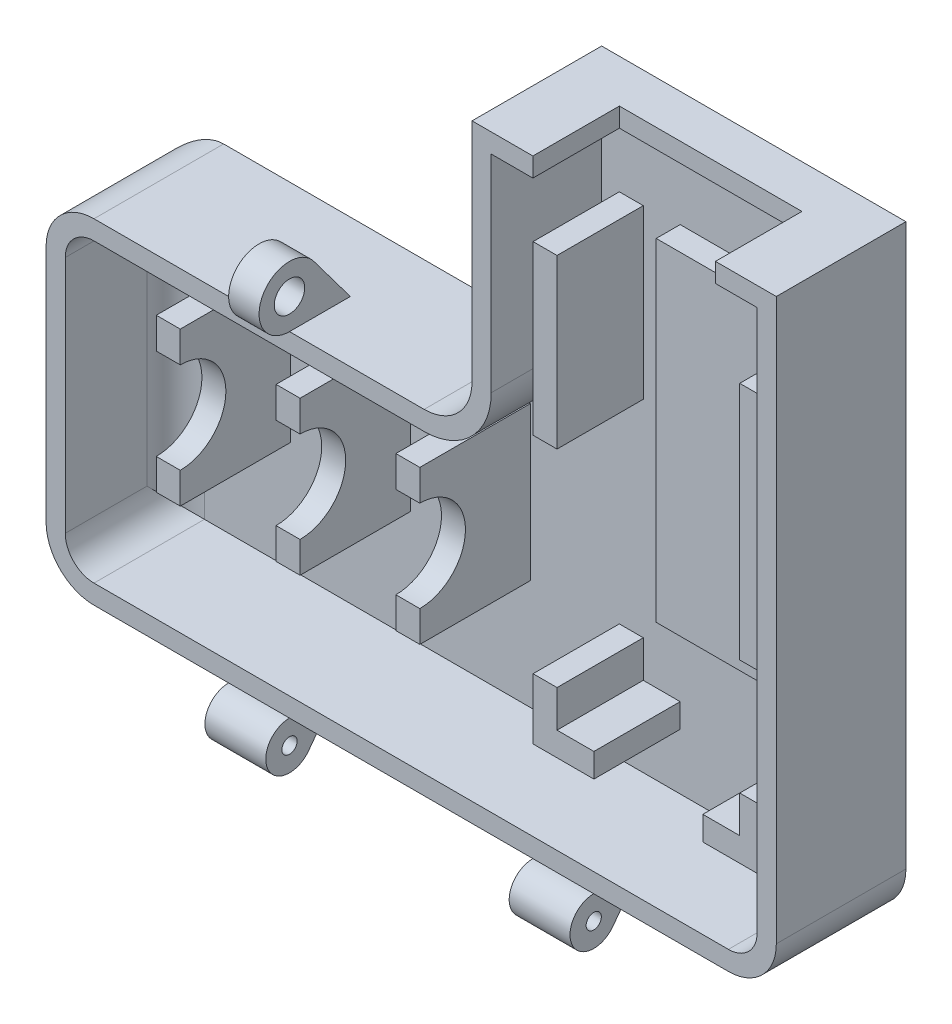
from build123d import *

# Parameters (mm, degrees)
SALIENTE_EXTRUIR1_DEPTH = 54.1
REDONDEO1_R             = 10
CROQUIS2_W              = 27.05
CROQUIS2_H              = 127
CORTAR_EXTRUIR1_DEPTH   = 206.624828267
VACIADO1_T              = -4
CROQUIS3_W              = 22.730580246
CROQUIS3_H              = 69.392963169
SALIENTE_EXTRUIR2_DEPTH = 5
CROQUIS3_3_W            = 5
CROQUIS3_3_H            = 50
CROQUIS3_3_H_2          = 35
SALIENTE_EXTRUIR3_DEPTH = 18
CROQUIS4_W              = 5
CROQUIS4_H              = 32.000123075
SALIENTE_EXTRUIR4_DEPTH = 23.05
CORTAR_EXTRUIR2_REACH   = 185.317
CROQUIS5_R              = 9.525
CROQUIS6_W              = 38.1
CROQUIS6_H              = 42.277753805
CORTAR_EXTRUIR3_DEPTH   = 18
CROQUIS7_W              = 180.240941947
CROQUIS7_H              = 148.875136133
CORTAR_EXTRUIR4_DEPTH   = 201.216039567
SALIENTE_EXTRUIR5_DEPTH = 12.7
CROQUIS9_R              = 1.5875
CORTAR_EXTRUIR5_DEPTH   = 174.832338789
CROQUIS10_R             = 3.175
SALIENTE_EXTRUIR6_DEPTH = 6.35


with BuildPart() as part:
    # Croquis1 → Saliente-Extruir1 (new body)
    with BuildSketch(Plane.XY):
        Polygon((0, 0), (0, 127), (63.5, 127), (63.5, 69.85), (152.4, 69.85), (152.4, 0), align=None)
    extrude(amount=SALIENTE_EXTRUIR1_DEPTH)

    # Redondeo1
    redondeo1_edges = [part.edges().sort_by_distance(p)[0] for p in [
        (63.5, 69.85, 27.05),
        (152.4, 69.85, 27.05),
        (152.4, 0, 27.05),
        (0, 0, 27.05),
        (152.4, 34.925, 0),
    ]]
    fillet(redondeo1_edges, radius=REDONDEO1_R)

    # Croquis2 → Cortar-Extruir1 (cut, through all)
    with BuildSketch(Plane(origin=(152.4, 0, 0), x_dir=(0, 0, -1), z_dir=(1, 0, 0))):
        with Locations((-40.575, 63.5)):
            Rectangle(CROQUIS2_W, CROQUIS2_H)
    extrude(amount=-CORTAR_EXTRUIR1_DEPTH, mode=Mode.SUBTRACT)

    # Vaciado1
    vaciado1_openings = [part.faces().sort_by_distance(p)[0] for p in [
        (64.737748774, 51.223088278, 27.05),
    ]]
    offset(amount=VACIADO1_T, openings=vaciado1_openings)

    # Croquis3 → Saliente-Extruir2 (add)
    with BuildSketch(Plane.XY.offset(4)):
        with Locations((31.75, 72.216754897)):
            Rectangle(CROQUIS3_W, CROQUIS3_H)
    extrude(amount=SALIENTE_EXTRUIR2_DEPTH)

    # Croquis3<3> → Saliente-Extruir3 (add)
    with BuildSketch(Plane.XY.offset(4)):
        with Locations((10.184709877, 77.438130808)):
            Rectangle(CROQUIS3_3_W, CROQUIS3_3_H)
        with Locations((53.315290123, 88.988130808)):
            Rectangle(CROQUIS3_3_W, CROQUIS3_3_H_2)
        Polygon((50.815290123, 20.688130808), (43.115290123, 20.688130808), (43.115290123, 15.688130808), (55.815290123, 15.688130808), (55.815290123, 28.388130808), (50.815290123, 28.388130808), align=None)
        Polygon((20.384709877, 20.688130808), (12.684709877, 20.688130808), (12.684709877, 28.388130808), (7.684709877, 28.388130808), (7.684709877, 15.688130808), (20.384709877, 15.688130808), align=None)
    extrude(amount=SALIENTE_EXTRUIR3_DEPTH)

    # Croquis4 → Saliente-Extruir4 (add)
    with BuildSketch(Plane.XY.offset(4)):
        with Locations((76.9, 42.913130808)):
            Rectangle(CROQUIS4_W, CROQUIS4_H)
        with Locations((101.9, 42.913130808)):
            Rectangle(CROQUIS4_W, CROQUIS4_H)
        with Locations((126.9, 42.913130808)):
            Rectangle(CROQUIS4_W, CROQUIS4_H)
    extrude(amount=SALIENTE_EXTRUIR4_DEPTH)

    # Cortar-Extruir2: up to this face of the body (flat: up to its plane)
    cortar_extruir2_end = Plane(part.part.faces().sort_by_distance((55.815290123, 22.038130808, 13))[0])
    # Croquis5 → Cortar-Extruir2 (cut, up to the picked face)
    with BuildSketch(Plane(origin=(129.4, 0, 0), x_dir=(0, 0, -1), z_dir=(1, 0, 0)), mode=Mode.PRIVATE) as cortar_extruir2_sk1:
        with Locations((-27.05, 42.913130808)):
            Circle(CROQUIS5_R)
    cortar_extruir2_tool1 = split(extrude(cortar_extruir2_sk1.sketch, amount=-CORTAR_EXTRUIR2_REACH, mode=Mode.PRIVATE), bisect_by=cortar_extruir2_end, keep=Keep.BOTH, mode=Mode.PRIVATE)
    add(cortar_extruir2_tool1.solids().sort_by(Axis((129.4, 42.913131, 27.05), (-1, 0, 0)))[0], mode=Mode.SUBTRACT)

    # Croquis6 → Cortar-Extruir3 (cut)
    with BuildSketch(Plane.XZ.offset(-123)):
        with Locations((31.75, 30.138876903)):
            Rectangle(CROQUIS6_W, CROQUIS6_H)
    extrude(amount=-CORTAR_EXTRUIR3_DEPTH, mode=Mode.SUBTRACT)

    # Simetría5: part across plane


with BuildPart() as part_1:
    add(part.part)
    add(part.part.mirror(Plane(origin=(0, 0, 54.1), x_dir=(0, 0, 1), z_dir=(1, 0, 0))))

    # Croquis7 → Cortar-Extruir4 (cut, through all)
    with BuildSketch(Plane.XY.offset(27.05)):
        with Locations((90.120470974, 52.562431934)):
            Rectangle(CROQUIS7_W, CROQUIS7_H)
    extrude(amount=-CORTAR_EXTRUIR4_DEPTH, mode=Mode.SUBTRACT)

    # Croquis8 → Saliente-Extruir5 (add)
    with BuildSketch(Plane(origin=(-38.1, 0, 0), x_dir=(0, 0, -1), z_dir=(1, 0, 0))):
        with BuildLine():
            Line((-27.05, 0), (-17.144, 0))
            Line((-17.144, 0), (-23.0876, -7.9248))
            ThreePointArc((-23.0876, -7.9248), (-31.480097877, -7.168048939), (-27.05, 0))
        make_face()
    saliente_extruir5 = extrude(amount=-SALIENTE_EXTRUIR5_DEPTH)

    # Croquis9 → Cortar-Extruir5 (cut, through all)
    with BuildSketch(Plane(origin=(-38.1, 0, 0), x_dir=(0, 0, -1), z_dir=(1, 0, 0))):
        with Locations((-27.05, -4.953)):
            Circle(CROQUIS9_R)
    cortar_extruir5 = extrude(amount=-CORTAR_EXTRUIR5_DEPTH, mode=Mode.SUBTRACT)

    # Simetría6: Saliente-Extruir5, Cortar-Extruir5 across plane
    add(saliente_extruir5.mirror(Plane(origin=(-76.2, 0, 0), x_dir=(0, 0, 1), z_dir=(1, 0, 0))))
    add(cortar_extruir5.mirror(Plane(origin=(-76.2, 0, 0), x_dir=(0, 0, 1), z_dir=(1, 0, 0))), mode=Mode.SUBTRACT)

    # Croquis10 → Saliente-Extruir6 (add)
    with BuildSketch(Plane.ZY.offset(107.95)):
        with BuildLine():
            Line((27.05, 69.85), (14.35, 69.85))
            Line((14.35, 69.85), (21.97, 80.01))
            ThreePointArc((21.97, 80.01), (32.729612663, 79.039806331), (27.05, 69.85))
        make_face()
        with Locations((27.05, 76.2)):
            Circle(CROQUIS10_R, mode=Mode.SUBTRACT)
    extrude(amount=-SALIENTE_EXTRUIR6_DEPTH)


solid = part_1.part
